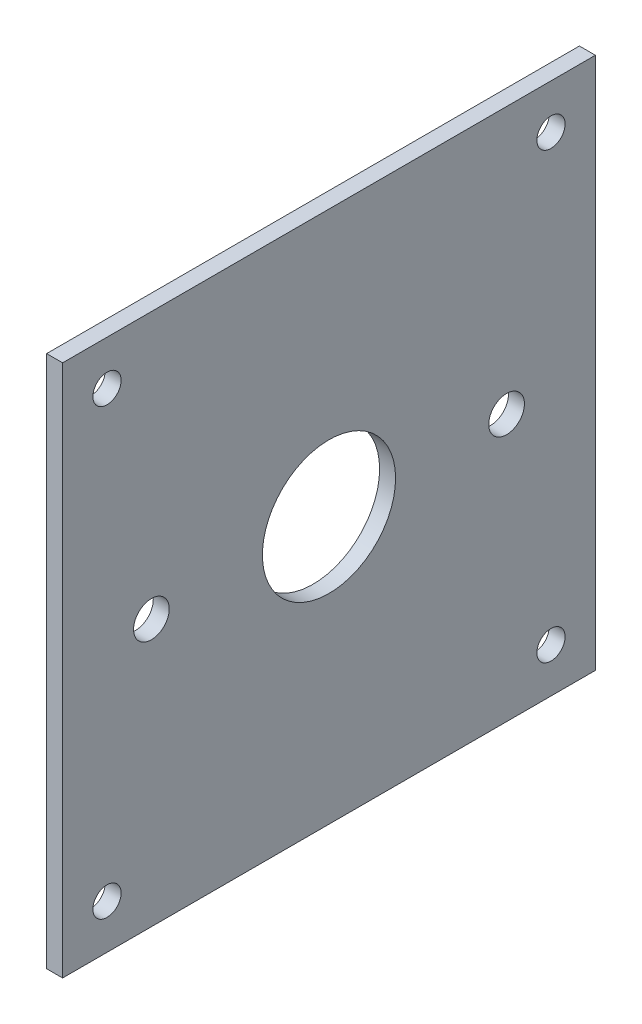
from build123d import *

# Parameters (mm, degrees)
SKETCH1_W           = 76.2
SKETCH1_H           = 76.2
SKETCH1_R           = 2.5527
SKETCH1_R_2         = 2.0193
SKETCH1_R_3         = 9.525
BOSS_EXTRUDE1_DEPTH = 2.286


with BuildPart() as part:
    # Sketch1 → Boss-Extrude1 (new body)
    with BuildSketch(Plane(origin=(0, 0, 0), x_dir=(0, 0, -1), z_dir=(1, 0, 0))):
        Rectangle(SKETCH1_W, SKETCH1_H)
        with Locations((-25.4, 0)):
            Circle(SKETCH1_R, mode=Mode.SUBTRACT)
        with Locations((-31.75, 31.75)):
            Circle(SKETCH1_R_2, mode=Mode.SUBTRACT)
        Circle(SKETCH1_R_3, mode=Mode.SUBTRACT)
        with Locations((25.4, 0)):
            Circle(SKETCH1_R, mode=Mode.SUBTRACT)
        with Locations((31.75, 31.75)):
            Circle(SKETCH1_R_2, mode=Mode.SUBTRACT)
        with Locations((31.75, -31.75)):
            Circle(SKETCH1_R_2, mode=Mode.SUBTRACT)
        with Locations((-31.75, -31.75)):
            Circle(SKETCH1_R_2, mode=Mode.SUBTRACT)
    extrude(amount=BOSS_EXTRUDE1_DEPTH)


solid = part.part
